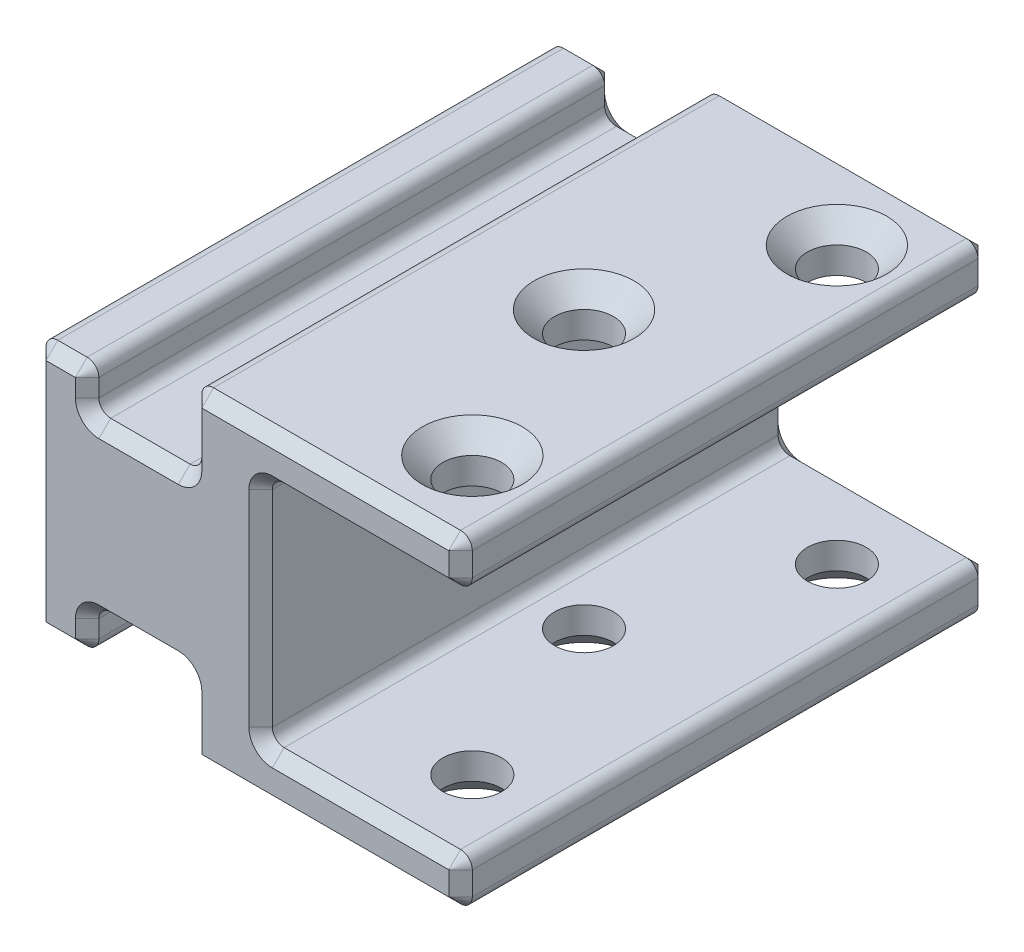
from build123d import *

# Parameters (mm, degrees)
BOSS_EXTRUDE1_DEPTH = 22.5
SKETCH2_R           = 2.5
CUT_EXTRUDE1_DEPTH  = 51.759851261
CHAMFER1_SIZE       = 1.75
FILLET1_R           = 1
CHAMFER2_SIZE       = 1


with BuildPart() as part:
    # Sketch1 → Boss-Extrude1 (new, symmetric)
    with BuildSketch(Plane.XY):
        Polygon((0, -10.625), (0, 10.625), (4.5, 10.625), (4.5, 7.125), (13.25, 7.125), (13.25, 13.75), (36.25, 13.75), (36.25, 9.75), (19.25, 9.75), (19.25, -9.75), (36.25, -9.75), (36.25, -13.75), (13.25, -13.75), (13.25, -7.125), (4.5, -7.125), (4.5, -10.625), align=None)
    extrude(amount=BOSS_EXTRUDE1_DEPTH, both=True)

    # Sketch2 → Cut-Extrude1 (cut, through all)
    with BuildSketch(Plane.XZ.offset(13.75)):
        with Locations(Location((30.25, 15.5, 0), (0, 0, 270))):
            Circle(SKETCH2_R)
        with Locations(Location((24.25, 0, 0), (0, 0, 270))):
            Circle(SKETCH2_R)
        with Locations(Location((30.25, -15.5, 0), (0, 0, 270))):
            Circle(SKETCH2_R)
    extrude(amount=-CUT_EXTRUDE1_DEPTH, mode=Mode.SUBTRACT)

    # Chamfer1
    chamfer1_edges = [part.edges().sort_by_distance(p)[0] for p in [
        (30.25, 13.75, 18),
        (30.25, -13.75, 18),
        (24.25, 13.75, 2.5),
        (24.25, -13.75, 2.5),
        (30.25, 13.75, -13),
        (30.25, -13.75, -13),
    ]]
    chamfer(chamfer1_edges, length=CHAMFER1_SIZE)

    # Fillet1
    fillet1_edges = [part.edges().sort_by_distance(p)[0] for p in [
        (4.5, 10.625, 0),
        (4.5, 7.125, 0),
        (13.25, 7.125, 0),
        (13.25, 13.75, 0),
        (36.25, 13.75, 0),
        (36.25, 9.75, 0),
        (19.25, 9.75, 0),
        (19.25, -9.75, 0),
        (36.25, -9.75, 0),
        (36.25, -13.75, 0),
        (13.25, -13.75, 0),
        (13.25, -7.125, 0),
        (4.5, -7.125, 0),
        (4.5, -10.625, 0),
        (0, -10.625, 0),
        (0, 10.625, 0),
    ]]
    fillet(fillet1_edges, radius=FILLET1_R)

    # Chamfer2
    chamfer2_edges = [part.edges().sort_by_distance(p)[0] for p in [
        (0, 0, -22.5),
        (4.207106781, -10.332106781, -22.5),
        (0.292893219, 10.332106781, -22.5),
        (0.292893219, -10.332106781, -22.5),
        (13.542893219, -13.457106781, -22.5),
        (35.957106781, -13.457106781, -22.5),
        (35.957106781, -10.042893219, -22.5),
        (35.957106781, 10.042893219, -22.5),
        (35.957106781, 13.457106781, -22.5),
        (13.542893219, 13.457106781, -22.5),
        (4.207106781, 10.332106781, -22.5),
        (4.5, 8.875, 22.5),
        (0, 0, 22.5),
        (2.25, -10.625, 22.5),
        (4.5, -8.875, 22.5),
        (8.875, -7.125, 22.5),
        (13.25, -10.4375, 22.5),
        (24.75, -13.75, 22.5),
        (36.25, -11.75, 22.5),
        (27.75, -9.75, 22.5),
        (19.25, 0, 22.5),
        (27.75, 9.75, 22.5),
        (36.25, 11.75, 22.5),
        (24.75, 13.75, 22.5),
        (13.25, 10.4375, 22.5),
        (8.875, 7.125, 22.5),
        (4.207106781, -10.332106781, 22.5),
        (0.292893219, 10.332106781, 22.5),
        (0.292893219, -10.332106781, 22.5),
        (13.542893219, -13.457106781, 22.5),
        (35.957106781, -13.457106781, 22.5),
        (35.957106781, -10.042893219, 22.5),
        (35.957106781, 10.042893219, 22.5),
        (35.957106781, 13.457106781, 22.5),
        (13.542893219, 13.457106781, 22.5),
        (4.207106781, 10.332106781, 22.5),
        (4.792893219, 7.417893219, -22.5),
        (4.792893219, 7.417893219, 22.5),
        (12.957106781, 7.417893219, -22.5),
        (12.957106781, 7.417893219, 22.5),
        (19.542893219, 9.457106781, -22.5),
        (19.542893219, 9.457106781, 22.5),
        (19.542893219, -9.457106781, -22.5),
        (19.542893219, -9.457106781, 22.5),
        (12.957106781, -7.417893219, -22.5),
        (12.957106781, -7.417893219, 22.5),
        (4.792893219, -7.417893219, -22.5),
        (4.792893219, -7.417893219, 22.5),
        (2.25, 10.625, -22.5),
        (2.25, 10.625, 22.5),
        (4.5, 8.875, -22.5),
        (8.875, 7.125, -22.5),
        (13.25, 10.4375, -22.5),
        (24.75, 13.75, -22.5),
        (36.25, 11.75, -22.5),
        (27.75, 9.75, -22.5),
        (19.25, 0, -22.5),
        (27.75, -9.75, -22.5),
        (36.25, -11.75, -22.5),
        (24.75, -13.75, -22.5),
        (13.25, -10.4375, -22.5),
        (8.875, -7.125, -22.5),
        (4.5, -8.875, -22.5),
        (2.25, -10.625, -22.5),
    ]]
    chamfer(chamfer2_edges, length=CHAMFER2_SIZE)


solid = part.part
